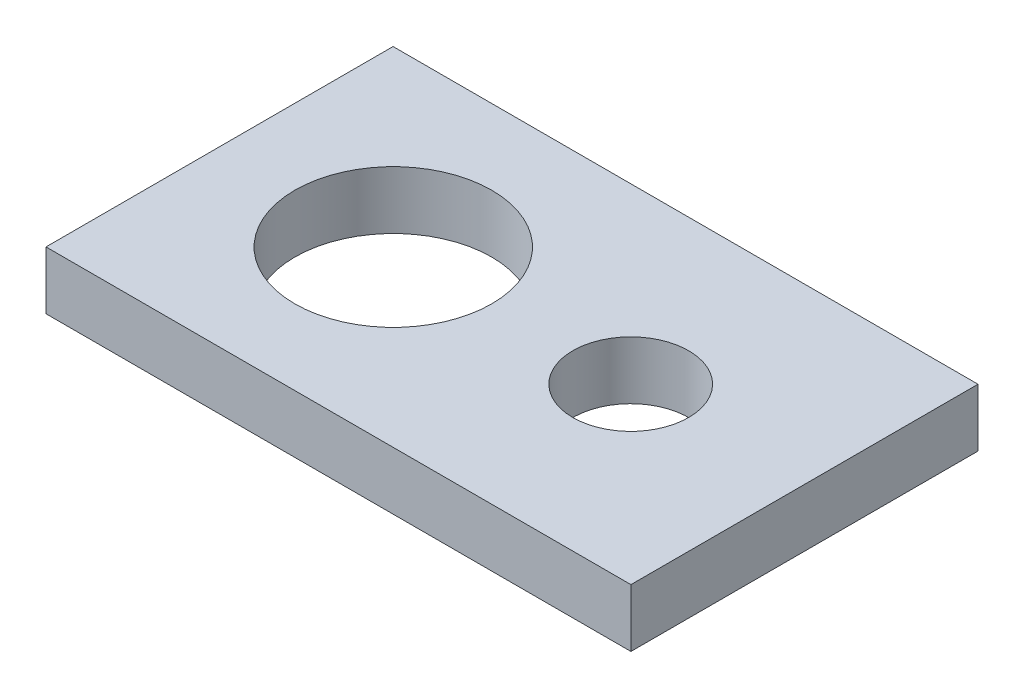
from build123d import *

# Parameters (mm, degrees)
SKETCH1_W           = 101
SKETCH1_H           = 59.932047928
SKETCH1_R           = 11
SKETCH1_R_2         = 10
BOSS_EXTRUDE1_DEPTH = 10
SKETCH2_R           = 17
CUT_EXTRUDE1_DEPTH  = 10


with BuildPart() as part:
    # Sketch1 → Boss-Extrude1 (new body)
    with BuildSketch(Plane(origin=(0, 0, 0), x_dir=(1, 0, 0), z_dir=(0, 1, 0))):
        Rectangle(SKETCH1_W, SKETCH1_H)
        with Locations(Location((-20.5, 0, 0), (0, 0, 270))):
            Circle(SKETCH1_R, mode=Mode.SUBTRACT)
        with Locations(Location((20.5, 0, 0), (0, 0, 270))):
            Circle(SKETCH1_R_2, mode=Mode.SUBTRACT)
    extrude(amount=BOSS_EXTRUDE1_DEPTH)

    # Sketch2 → Cut-Extrude1 (cut)
    with BuildSketch(Plane(origin=(0, 10, 0), x_dir=(1, 0, 0), z_dir=(0, 1, 0))):
        with Locations(Location((-20.5, 0, 0), (0, 0, 270))):
            Circle(SKETCH2_R)
    extrude(amount=-CUT_EXTRUDE1_DEPTH, mode=Mode.SUBTRACT)


solid = part.part
